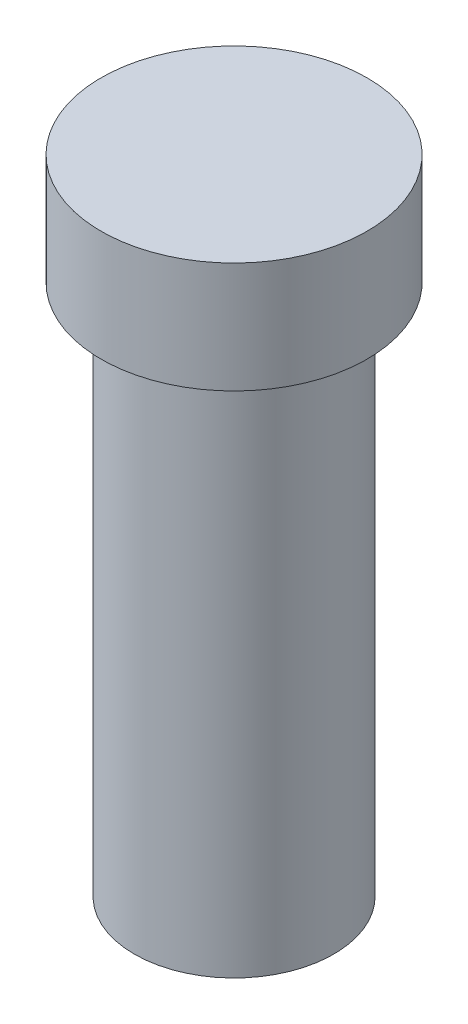
from build123d import *


with BuildPart() as part:
    # Sketch3 → Revolve1 (revolve)
    with BuildSketch(Plane.XY, mode=Mode.PRIVATE) as revolve1_sk:
        Polygon((0, 0), (0, 368.3), (76.2, 368.3), (76.2, 304.8), (57.15, 304.8), (57.15, 0), align=None)
    revolve(revolve1_sk.sketch.rotate(Axis((0, 0, 0), (0, 1, 0)), 90), axis=Axis((0, 0, 0), (0, 1, 0)))


solid = part.part
